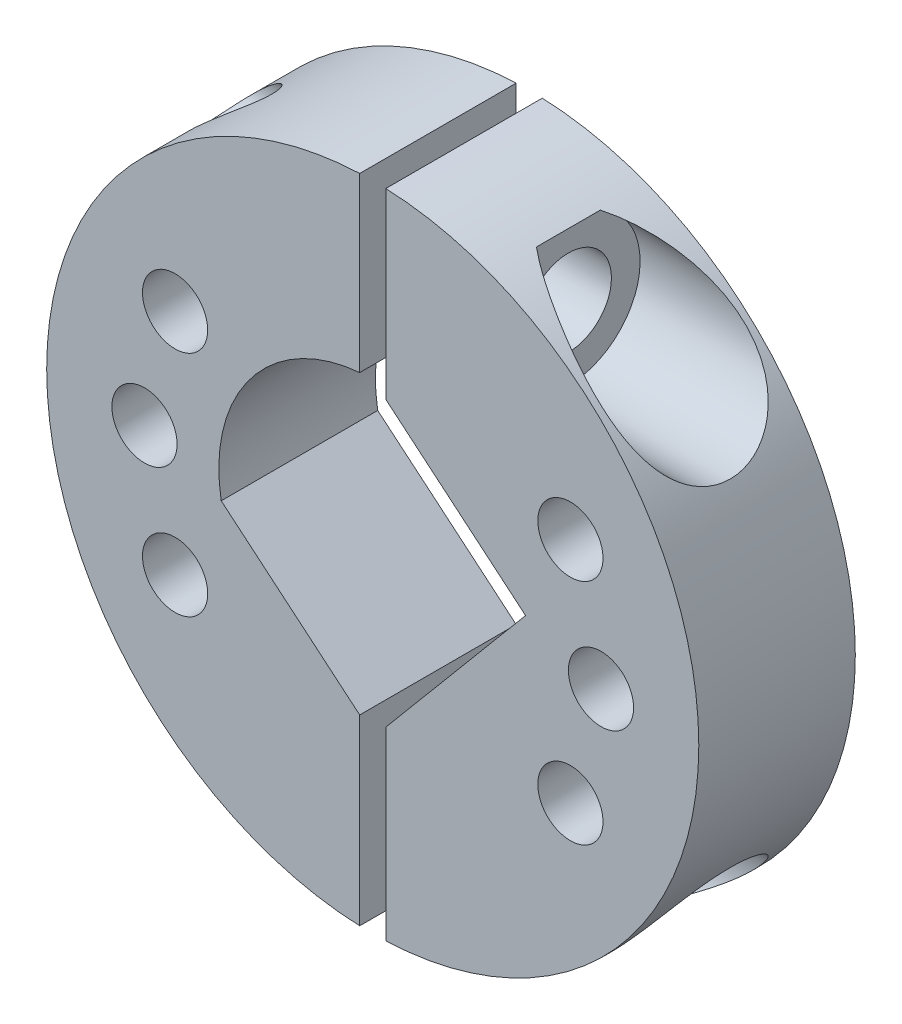
from build123d import *

# Parameters (mm, degrees)
SKETCH_7_R                  = 25
EXTRUDE_1_DEPTH             = 6
M6X1_0_1_D                  = 5
PATTERN_CIRCULAR_2_COUNT    = 12
CUT_EXTRUDE_1_DEPTH         = 36.860842154
CUT_EXTRUDE_1_DEPTH_BACK    = 36.860842154
HOLE_WIZARD_M6_1_AT_2_COUNT = 2
HOLE_WIZARD_M6_1_AT_2_PITCH = 36.8
SKETCH_29_W                 = 2.5
SKETCH_29_H                 = 40
M6X1_0_3_AT_2_COUNT         = 2
M6X1_0_3_AT_2_PITCH         = 36.8
SKETCH_30_R                 = 5.5
CUT_EXTRUDE_2_DEPTH         = 48.539457445


with BuildPart() as part:
    # 스케치7 → 보스-돌출1 (new, symmetric)
    with BuildSketch(Plane.XY):
        Circle(SKETCH_7_R)
        with BuildLine():
            Line((11.71577008, 1.983237616), (0.081314344, -11.882166805))
            Line((0.081314344, -11.882166805), (-11.617833542, -2.065416128))
            ThreePointArc((-11.617833542, -2.065416128), (-9.039324429, 7.584893794), (0.016622193, 11.799988292))
            Line((0.016622193, 11.799988292), (11.71577008, 1.983237616))
        make_face(mode=Mode.SUBTRACT)
    extrude(amount=EXTRUDE_1_DEPTH, both=True)

    # M6x1.0 나사 구멍1 (through all)
    with Locations(Plane.XY.offset(6)):
        with Locations((17.5, 0)):
            m6x1_0_1 = Hole(M6X1_0_1_D / 2)

    # 원형 패턴2: M6x1.0 나사 구멍1 ×12 about axis, 6 skipped
    pattern_circular_2_axis = Axis((0, 0, 0), (0, 0, -1))
    add([m6x1_0_1.rotate(pattern_circular_2_axis, i * 360 / PATTERN_CIRCULAR_2_COUNT) for i in range(1, PATTERN_CIRCULAR_2_COUNT) if i not in (2, 3, 4, 8, 9, 10)], mode=Mode.SUBTRACT)

    # 스케치19 → 컷-돌출1 (cut, two sides: drawn at the far end of the back side and taken through both)
    with BuildSketch(Plane.XY.offset(-CUT_EXTRUDE_1_DEPTH_BACK)):
        with BuildLine():
            Line((1, 24.979991994), (1, -24.979991994))
            ThreePointArc((1, -24.979991994), (0, -25), (-1, -24.979991994))
            Line((-1, -24.979991994), (-1, 24.979991994))
            ThreePointArc((-1, 24.979991994), (0, 25), (1, 24.979991994))
        make_face()
    extrude(amount=CUT_EXTRUDE_1_DEPTH + CUT_EXTRUDE_1_DEPTH_BACK, mode=Mode.SUBTRACT)


with BuildPart() as cut_extrude_1_piece_1:
    # of the separate pieces the step leaves, piece 1, a body of its own (cut_extrude_1_pieces)
    add(part.part.solids().sort_by_distance((1, 24.979991994, 6))[0])

    # 스케치23 → M6 소켓 머리 캡 나사용 카운터보어1 (revolve, cut)
    with BuildSketch(Plane(origin=(15, 18.4, 0), x_dir=(0, 0, -1), z_dir=(0, 1, 0))):
        Polygon((0, 0), (0, 40), (3.3, 40), (3.3, 6), (5.5, 6), (5.5, 0), align=None)
    hole_wizard_m6_1 = revolve(axis=Axis((21.35, 18.4, 0), (-1, 0, 0)), mode=Mode.SUBTRACT)

    # M6 소켓 머리 캡 나사용 카운터보어1 at 2: M6 소켓 머리 캡 나사용 카운터보어1 ×2
    with Locations(*[(0, -i * HOLE_WIZARD_M6_1_AT_2_PITCH, 0) for i in range(1, HOLE_WIZARD_M6_1_AT_2_COUNT)]):
        add(hole_wizard_m6_1, mode=Mode.SUBTRACT)

    # 스케치30 → 컷-돌출2 (cut, through all)
    with BuildSketch(Plane(origin=(15, 0, 0), x_dir=(0, 0, -1), z_dir=(1, 0, 0))):
        with Locations((0, 18.4)):
            Circle(SKETCH_30_R)
        with Locations((0, -18.4)):
            Circle(SKETCH_30_R)
    extrude(amount=CUT_EXTRUDE_2_DEPTH, mode=Mode.SUBTRACT)


with BuildPart() as cut_extrude_1_piece_2:
    # of the separate pieces the step leaves, piece 2, a body of its own (cut_extrude_1_pieces)
    add(part.part.solids().sort_by_distance((-1, 24.979991994, -6))[0])

    # 스케치29 → M6x1.0 나사 구멍3 (revolve, cut)
    with BuildSketch(Plane(origin=(15, 18.4, 0), x_dir=(0, 0, -1), z_dir=(0, 1, 0))):
        with Locations((1.25, 20)):
            Rectangle(SKETCH_29_W, SKETCH_29_H)
    m6x1_0_3 = revolve(axis=Axis((21.35, 18.4, 0), (-1, 0, 0)), mode=Mode.SUBTRACT)

    # M6x1.0 나사 구멍3 at 2: M6x1.0 나사 구멍3 ×2
    with Locations(*[(0, -i * M6X1_0_3_AT_2_PITCH, 0) for i in range(1, M6X1_0_3_AT_2_COUNT)]):
        add(m6x1_0_3, mode=Mode.SUBTRACT)


solid = Compound([cut_extrude_1_piece_1.part, cut_extrude_1_piece_2.part])
